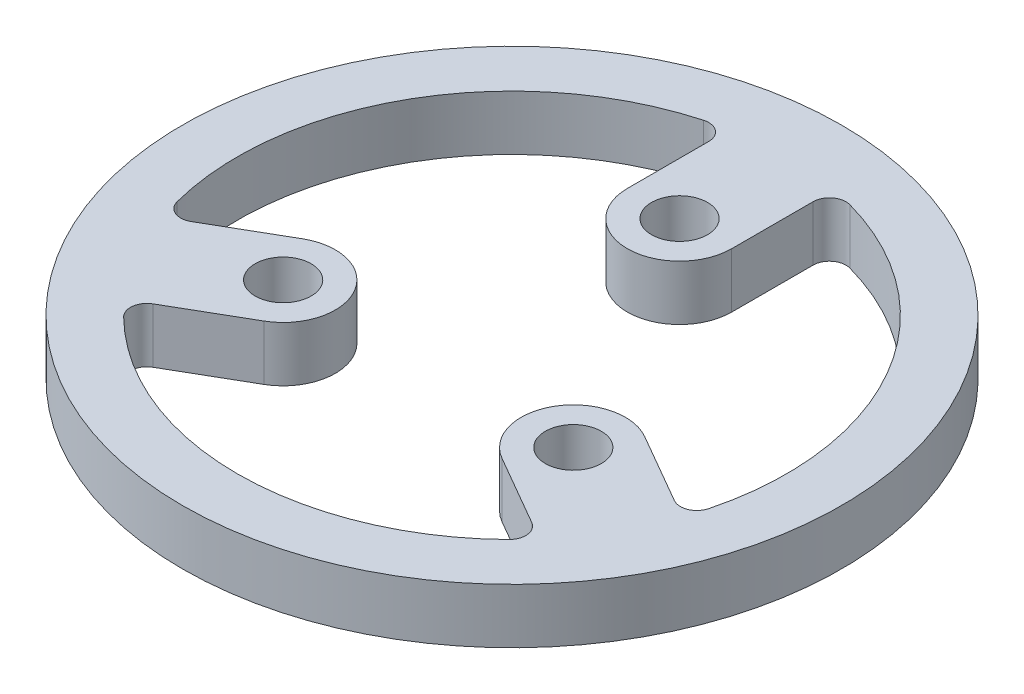
from build123d import *

# Parameters (mm, degrees)
SKETCH1_R           = 30
SKETCH1_R_2         = 25
BOSS_EXTRUDE1_DEPTH = 5
BOSS_EXTRUDE2_START = -5
SKETCH2_R           = 2.55
BOSS_EXTRUDE2_DEPTH = 5
CIRPATTERN1_COUNT   = 3
FILLET1_R           = 1.5


with BuildPart() as part:
    # Sketch1 → Boss-Extrude1 (new body)
    with BuildSketch(Plane(origin=(0, 0, 0), x_dir=(1, 0, 0), z_dir=(0, 1, 0))):
        with Locations(Location((0, 0, 0), (0, 0, 270))):
            Circle(SKETCH1_R)
        with Locations(Location((0, 0, 0), (0, 0, 270))):
            Circle(SKETCH1_R_2, mode=Mode.SUBTRACT)
    extrude(amount=BOSS_EXTRUDE1_DEPTH)

    # Sketch2 → Boss-Extrude2 (add)
    with BuildSketch(Plane(origin=(0, 5, 0), x_dir=(1, 0, 0), z_dir=(0, 1, 0)).offset(BOSS_EXTRUDE2_START)):
        with BuildLine():
            Line((-4.75, 15.25), (-4.75, 24.544602258))
            ThreePointArc((-4.75, 24.544602258), (0, 25), (4.75, 24.544602258))
            Line((4.75, 24.544602258), (4.75, 15.25))
            ThreePointArc((4.75, 15.25), (0, 10.5), (-4.75, 15.25))
        make_face()
        with Locations(Location((0, 15.25, 0), (0, 0, 270))):
            Circle(SKETCH2_R, mode=Mode.SUBTRACT)
    boss_extrude2 = extrude(amount=BOSS_EXTRUDE2_DEPTH)

    # CirPattern1: Boss-Extrude2 ×3 about axis
    cirpattern1_axis = Axis((0, 0, 0), (0, 1, 0))
    for i in range(1, CIRPATTERN1_COUNT):
        add(boss_extrude2.rotate(cirpattern1_axis, i * 360 / CIRPATTERN1_COUNT))

    # Fillet1
    fillet1_edges = [part.edges().sort_by_distance(p)[0] for p in [
        (4.75, 2.5, -24.544602258),
        (-4.75, 2.5, -24.544602258),
        (18.881249081, 2.5, 16.385921797),
        (23.631249081, 2.5, 8.158680461),
        (-23.631249081, 2.5, 8.158680461),
        (-18.881249081, 2.5, 16.385921797),
    ]]
    fillet(fillet1_edges, radius=FILLET1_R)


solid = part.part
